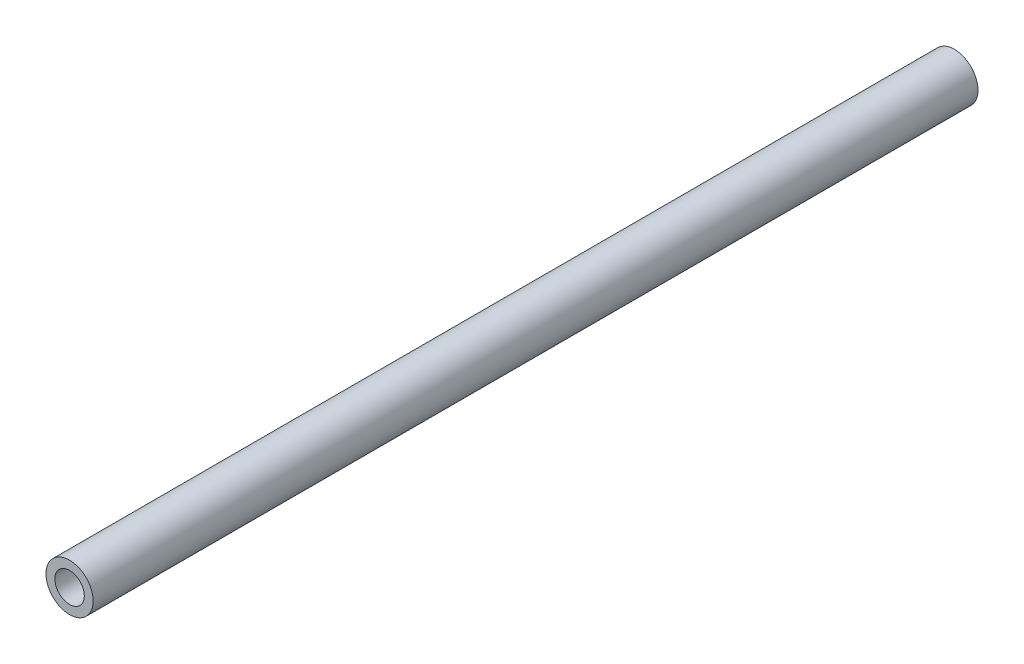
from build123d import *

# Parameters (mm, degrees)
SKETCH_1_R          = 4
EXTRUDE_1_DEPTH     = 150
SKETCH_2_R          = 2.5
CUT_EXTRUDE_1_DEPTH = 330


with BuildPart() as part:
    # 草图1 → 凸台-拉伸1 (new body)
    with BuildSketch(Plane.XY):
        Circle(SKETCH_1_R)
    extrude(amount=EXTRUDE_1_DEPTH)

    # 草图2 → 切除-拉伸1 (cut)
    with BuildSketch(Plane.XY.offset(150)):
        Circle(SKETCH_2_R)
    extrude(amount=-CUT_EXTRUDE_1_DEPTH, mode=Mode.SUBTRACT)


solid = part.part
